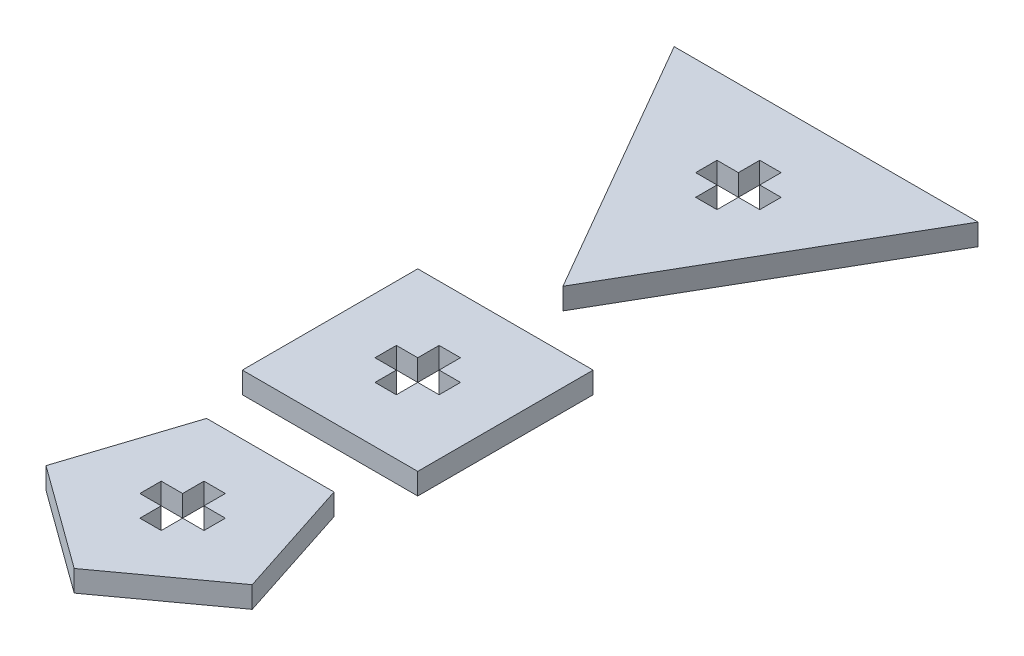
from build123d import *

# Parameters (mm, degrees)
BOSS_EXTRUDE1_DEPTH   = 5.08
SKETCH3_W             = 41.68902
SKETCH3_H             = 41.68902
BOSS_EXTRUDE1_2_DEPTH = 5.08
BOSS_EXTRUDE1_3_DEPTH = 5.08


with BuildPart() as part:
    # Sketch3 → Boss-Extrude1 (new body)
    with BuildSketch(Plane(origin=(0, 0, 0), x_dir=(1, 0, 0), z_dir=(0, 1, 0))):
        Polygon((-14.749865829, 0.888926026), (21.35388455, 63.422456026), (-50.853616208, 63.422456026), align=None)
        Polygon((-14.749865829, 50.197946026), (-12.209865829, 50.197946026), (-12.209865829, 45.117946026), (-7.129865829, 45.117946026), (-7.129865829, 42.577946026), (-7.129865829, 40.037946026), (-12.209865829, 40.037946026), (-12.209865829, 34.957946026), (-14.749865829, 34.957946026), (-17.289865829, 34.957946026), (-17.289865829, 40.037946026), (-22.369865829, 40.037946026), (-22.369865829, 42.577946026), (-22.369865829, 45.117946026), (-17.289865829, 45.117946026), (-17.289865829, 50.197946026), align=None, mode=Mode.SUBTRACT)
    extrude(amount=BOSS_EXTRUDE1_DEPTH)


with BuildPart() as body_2:
    # Sketch3 → Boss-Extrude1 2 (new body)
    with BuildSketch(Plane(origin=(0, 0, 0), x_dir=(1, 0, 0), z_dir=(0, 1, 0))):
        with Locations((-14.749865829, -33.622053974)):
            Rectangle(SKETCH3_W, SKETCH3_H)
        Polygon((-7.129865829, -31.082053974), (-7.129865829, -33.622053974), (-7.129865829, -36.162053974), (-12.209865829, -36.162053974), (-12.209865829, -41.242053974), (-14.749865829, -41.242053974), (-17.289865829, -41.242053974), (-17.289865829, -36.162053974), (-22.369865829, -36.162053974), (-22.369865829, -33.622053974), (-22.369865829, -31.082053974), (-17.289865829, -31.082053974), (-17.289865829, -26.002053974), (-14.749865829, -26.002053974), (-12.209865829, -26.002053974), (-12.209865829, -31.082053974), align=None, mode=Mode.SUBTRACT)
    extrude(amount=BOSS_EXTRUDE1_2_DEPTH)


with BuildPart() as body_3:
    # Sketch3 → Boss-Extrude1 3 (new body)
    with BuildSketch(Plane(origin=(0, 0, 0), x_dir=(1, 0, 0), z_dir=(0, 1, 0))):
        Polygon((-14.749865829, -115.267285291), (9.754325309, -97.463948315), (0.394557161, -68.657543974), (-29.894288819, -68.657543974), (-39.254056968, -97.463948315), align=None)
        Polygon((-22.369865829, -92.042053974), (-22.369865829, -89.502053974), (-22.369865829, -86.962053974), (-17.289865829, -86.962053974), (-17.289865829, -81.882053974), (-14.749865829, -81.882053974), (-12.209865829, -81.882053974), (-12.209865829, -86.962053974), (-7.129865829, -86.962053974), (-7.129865829, -89.502053974), (-7.129865829, -92.042053974), (-12.209865829, -92.042053974), (-12.209865829, -97.122053974), (-14.749865829, -97.122053974), (-17.289865829, -97.122053974), (-17.289865829, -92.042053974), align=None, mode=Mode.SUBTRACT)
    extrude(amount=BOSS_EXTRUDE1_3_DEPTH)


solid = Compound([part.part, body_2.part, body_3.part])
